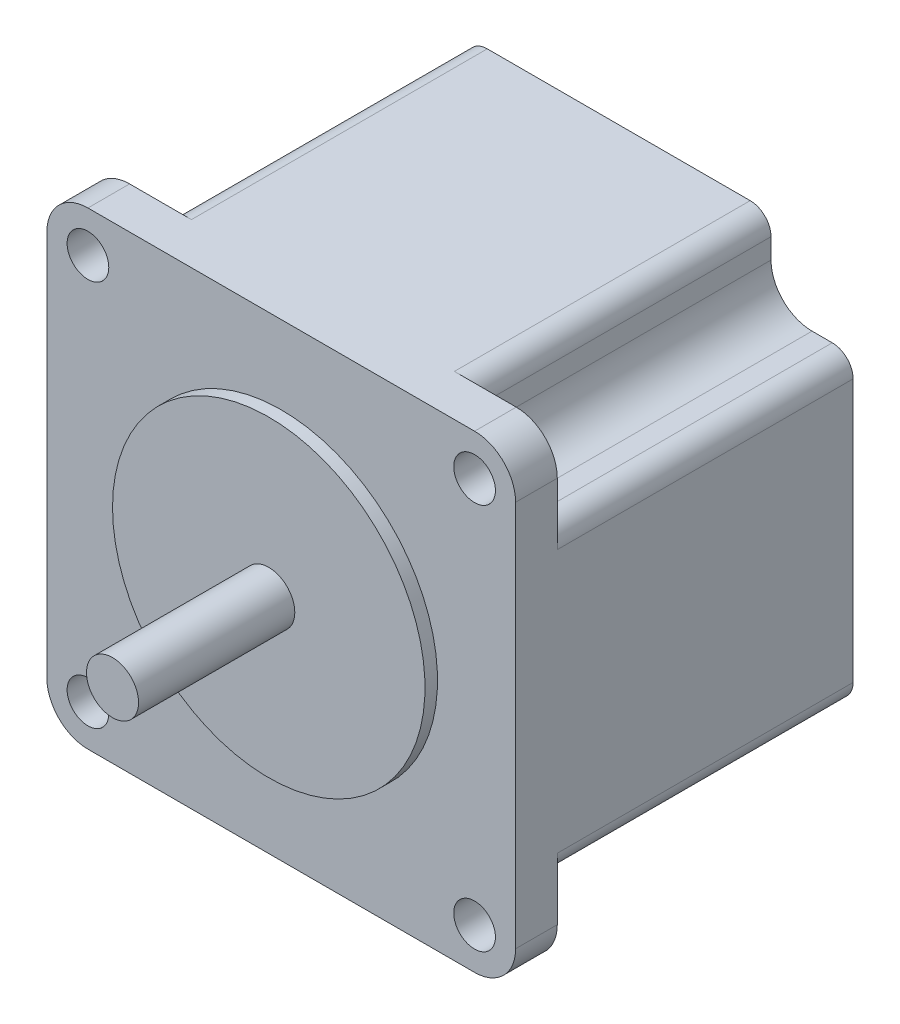
from build123d import *

# Parameters (mm, degrees)
SKETCH1_R      = 2.54
EXTRUDE1_DEPTH = 20.574
SKETCH2_R      = 19.05
EXTRUDE2_DEPTH = 1.524
SKETCH3_R      = 3.175
EXTRUDE3_DEPTH = 20.574
EXTRUDE4_START = -36.068
EXTRUDE4_DEPTH = 36.068
FILLET1_R      = 2.54
EXTRUDE5_START = 14.986
SKETCH5_R      = 3.175
EXTRUDE5_DEPTH = 14.986
SKETCH6_R      = 1.07823
EXTRUDE6_DEPTH = 3.81


with BuildPart() as part:
    # Sketch1 → Extrude1 (new, symmetric)
    with BuildSketch(Plane.XY):
        with BuildLine():
            Line((-23.5712, 28.575), (23.5712, 28.575))
            ThreePointArc((23.5712, 28.575), (27.109420912, 27.109420912), (28.575, 23.5712))
            Line((28.575, 23.5712), (28.575, -23.5712))
            ThreePointArc((28.575, -23.5712), (27.109420912, -27.109420912), (23.5712, -28.575))
            Line((23.5712, -28.575), (-23.5712, -28.575))
            ThreePointArc((-23.5712, -28.575), (-27.109420912, -27.109420912), (-28.575, -23.5712))
            Line((-28.575, -23.5712), (-28.575, 23.5712))
            ThreePointArc((-28.575, 23.5712), (-27.109420912, 27.109420912), (-23.5712, 28.575))
        make_face()
        with Locations((-23.5712, 23.5712)):
            Circle(SKETCH1_R, mode=Mode.SUBTRACT)
        with Locations((23.5712, 23.5712)):
            Circle(SKETCH1_R, mode=Mode.SUBTRACT)
        with Locations((23.5712, -23.5712)):
            Circle(SKETCH1_R, mode=Mode.SUBTRACT)
        with Locations((-23.5712, -23.5712)):
            Circle(SKETCH1_R, mode=Mode.SUBTRACT)
    extrude(amount=EXTRUDE1_DEPTH, both=True)

    # Sketch2 → Extrude2 (add)
    with BuildSketch(Plane.XY.offset(20.574)):
        with Locations(Location((0, 0, 0), (0, 0, 180))):
            Circle(SKETCH2_R)
    extrude(amount=EXTRUDE2_DEPTH)

    # Sketch3 → Extrude3 (add)
    with BuildSketch(Plane.XY.offset(20.574)):
        Circle(SKETCH3_R)
    extrude(amount=EXTRUDE3_DEPTH)

    # Sketch4 → Extrude4 (cut)
    with BuildSketch(Plane(origin=(0, 0, -20.574), x_dir=(-1, 0, 0), z_dir=(0, 0, -1)).offset(EXTRUDE4_START)):
        with BuildLine():
            Line((-23.5712, 18.5674), (-28.575, 18.5674))
            Line((-28.575, 18.5674), (-28.575, 23.5712))
            ThreePointArc((-28.575, 23.5712), (-27.109420912, 27.109420912), (-23.5712, 28.575))
            Line((-23.5712, 28.575), (-18.5674, 28.575))
            Line((-18.5674, 28.575), (-18.5674, 23.5712))
            ThreePointArc((-18.5674, 23.5712), (-20.032979088, 20.032979088), (-23.5712, 18.5674))
        make_face()
        with BuildLine():
            Line((23.5712, 18.5674), (28.575, 18.5674))
            Line((28.575, 18.5674), (28.575, 23.5712))
            ThreePointArc((28.575, 23.5712), (27.109420912, 27.109420912), (23.5712, 28.575))
            Line((23.5712, 28.575), (18.5674, 28.575))
            Line((18.5674, 28.575), (18.5674, 23.5712))
            ThreePointArc((18.5674, 23.5712), (20.032979088, 20.032979088), (23.5712, 18.5674))
        make_face()
        with BuildLine():
            Line((23.5712, -18.5674), (28.575, -18.5674))
            Line((28.575, -18.5674), (28.575, -23.5712))
            ThreePointArc((28.575, -23.5712), (27.109420912, -27.109420912), (23.5712, -28.575))
            Line((23.5712, -28.575), (18.5674, -28.575))
            Line((18.5674, -28.575), (18.5674, -23.5712))
            ThreePointArc((18.5674, -23.5712), (20.032979088, -20.032979088), (23.5712, -18.5674))
        make_face()
        with BuildLine():
            Line((-18.5674, -23.5712), (-18.5674, -28.575))
            Line((-18.5674, -28.575), (-23.5712, -28.575))
            ThreePointArc((-23.5712, -28.575), (-27.109420912, -27.109420912), (-28.575, -23.5712))
            Line((-28.575, -23.5712), (-28.575, -18.5674))
            Line((-28.575, -18.5674), (-23.5712, -18.5674))
            ThreePointArc((-23.5712, -18.5674), (-20.032979088, -20.032979088), (-18.5674, -23.5712))
        make_face()
    extrude(amount=EXTRUDE4_DEPTH, mode=Mode.SUBTRACT)

    # Fillet1
    fillet1_edges = [part.edges().sort_by_distance(p)[0] for p in [
        (28.575, -18.5674, -2.54),
        (18.5674, -28.575, -2.54),
        (18.5674, 28.575, -2.54),
        (28.575, 18.5674, -2.54),
        (-28.575, 18.5674, -2.54),
        (-18.5674, 28.575, -2.54),
        (-18.5674, -28.575, -2.54),
        (-28.575, -18.5674, -2.54),
    ]]
    fillet(fillet1_edges, radius=FILLET1_R)

    # Sketch5 → Extrude5 (add)
    with BuildSketch(Plane(origin=(0, 0, -20.574), x_dir=(-1, 0, 0), z_dir=(0, 0, -1)).offset(EXTRUDE5_START)):
        with Locations(Location((0, 0, 0), (0, 0, 180))):
            Circle(SKETCH5_R)
    extrude(amount=-EXTRUDE5_DEPTH)

    # Sketch6 → Extrude6 (cut)
    with BuildSketch(Plane(origin=(0, 0, -20.574), x_dir=(-1, 0, 0), z_dir=(0, 0, -1))):
        with Locations((-23.0124, 0)):
            Circle(SKETCH6_R)
        with Locations((23.0124, 0)):
            Circle(SKETCH6_R)
    extrude(amount=-EXTRUDE6_DEPTH, mode=Mode.SUBTRACT)


solid = part.part
